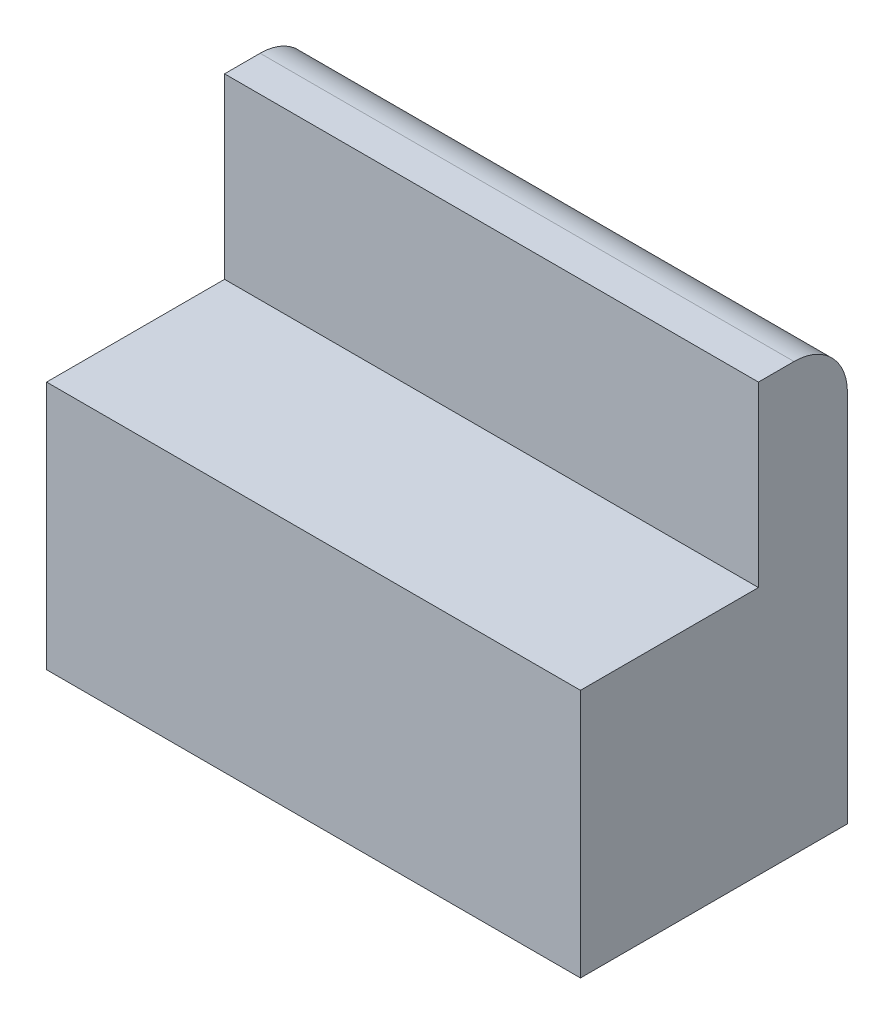
from build123d import *

# Parameters (mm, degrees)
SKETCH_1_W          = 30
SKETCH_1_H          = 24
EXTRUDE_1_DEPTH     = 15
SKETCH_2_W          = 30
SKETCH_2_H          = 10
CUT_EXTRUDE_1_DEPTH = 10
FILLET_1_R          = 3


with BuildPart() as part:
    # 草图1 → 凸台-拉伸1 (new body)
    with BuildSketch(Plane.XY):
        with Locations((-10.346525097, 8.485714286)):
            Rectangle(SKETCH_1_W, SKETCH_1_H)
    extrude(amount=EXTRUDE_1_DEPTH)

    # 草图2 → 切除-拉伸1 (cut)
    with BuildSketch(Plane.XY.offset(15)):
        with Locations((-10.346525097, 15.485714286)):
            Rectangle(SKETCH_2_W, SKETCH_2_H)
    extrude(amount=-CUT_EXTRUDE_1_DEPTH, mode=Mode.SUBTRACT)

    # 圆角1
    fillet_1_edges = [part.edges().sort_by_distance(p)[0] for p in [
        (-10.346525097, 20.485714286, 0),
    ]]
    fillet(fillet_1_edges, radius=FILLET_1_R)


solid = part.part
